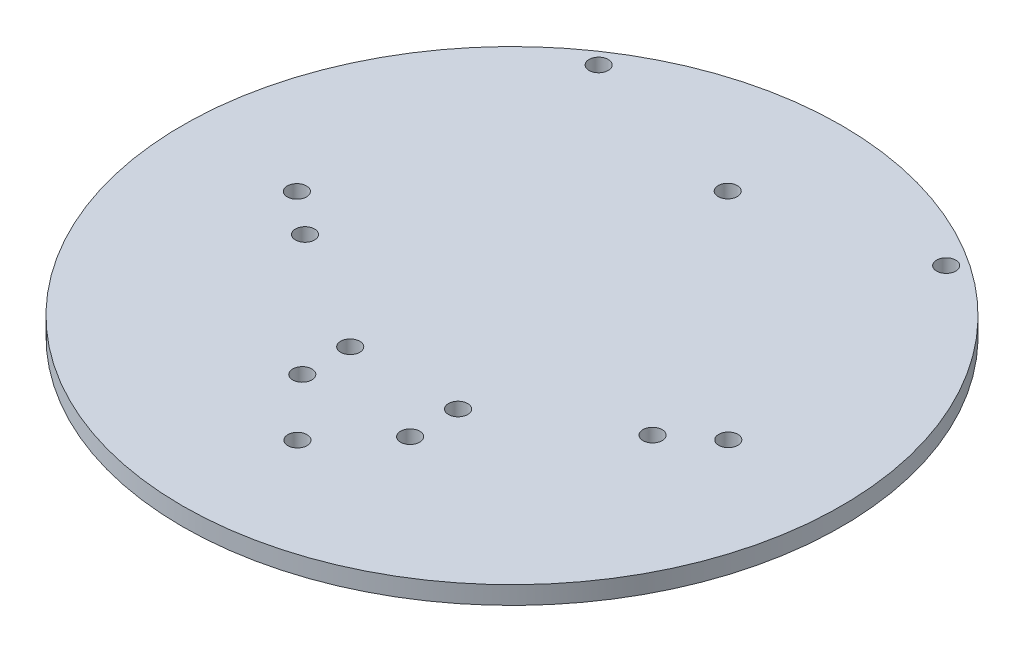
from build123d import *

# Parameters (mm, degrees)
SKETCH_1_R      = 55
SKETCH_1_R_2    = 1.6
EXTRUDE_2_DEPTH = 3


with BuildPart() as part:
    # 草图1 → 凸台-拉伸2 (new body)
    with BuildSketch(Plane(origin=(0, 0, 0), x_dir=(1, 0, 0), z_dir=(0, 1, 0))):
        with Locations(Location((0, 0, 0), (0, 0, 270))):
            Circle(SKETCH_1_R)
        with Locations(Location((35.999871065, 0.096349823, 0), (0, 0, 270))):
            Circle(SKETCH_1_R_2, mode=Mode.SUBTRACT)
        with Locations(Location((0.096220911, -35.90222552, 0), (0, 0, 270))):
            Circle(SKETCH_1_R_2, mode=Mode.SUBTRACT)
        with Locations(Location((-35.902354431, 0.001424634, 0), (0, 0, 270))):
            Circle(SKETCH_1_R_2, mode=Mode.SUBTRACT)
        with Locations(Location((0.001295723, 35.999999977, 0), (0, 0, 270))):
            Circle(SKETCH_1_R_2, mode=Mode.SUBTRACT)
        with Locations(Location((-28.998704277, 43.457275309, 0), (0, 0, 270))):
            Circle(SKETCH_1_R_2, mode=Mode.SUBTRACT)
        with Locations(Location((29.001295723, 43.457275309, 0), (0, 0, 270))):
            Circle(SKETCH_1_R_2, mode=Mode.SUBTRACT)
        with Locations(Location((29, -5.542724674, 0), (0, 0, 270))):
            Circle(SKETCH_1_R_2, mode=Mode.SUBTRACT)
        with Locations(Location((-29, -5.542724674, 0), (0, 0, 270))):
            Circle(SKETCH_1_R_2, mode=Mode.SUBTRACT)
        with Locations(Location((-9, -26, 0), (0, 0, 270))):
            Circle(SKETCH_1_R_2, mode=Mode.SUBTRACT)
        with Locations(Location((-9, -18, 0), (0, 0, 270))):
            Circle(SKETCH_1_R_2, mode=Mode.SUBTRACT)
        with Locations(Location((9, -26, 0), (0, 0, 270))):
            Circle(SKETCH_1_R_2, mode=Mode.SUBTRACT)
        with Locations(Location((9, -18, 0), (0, 0, 270))):
            Circle(SKETCH_1_R_2, mode=Mode.SUBTRACT)
    extrude(amount=EXTRUDE_2_DEPTH)


solid = part.part
